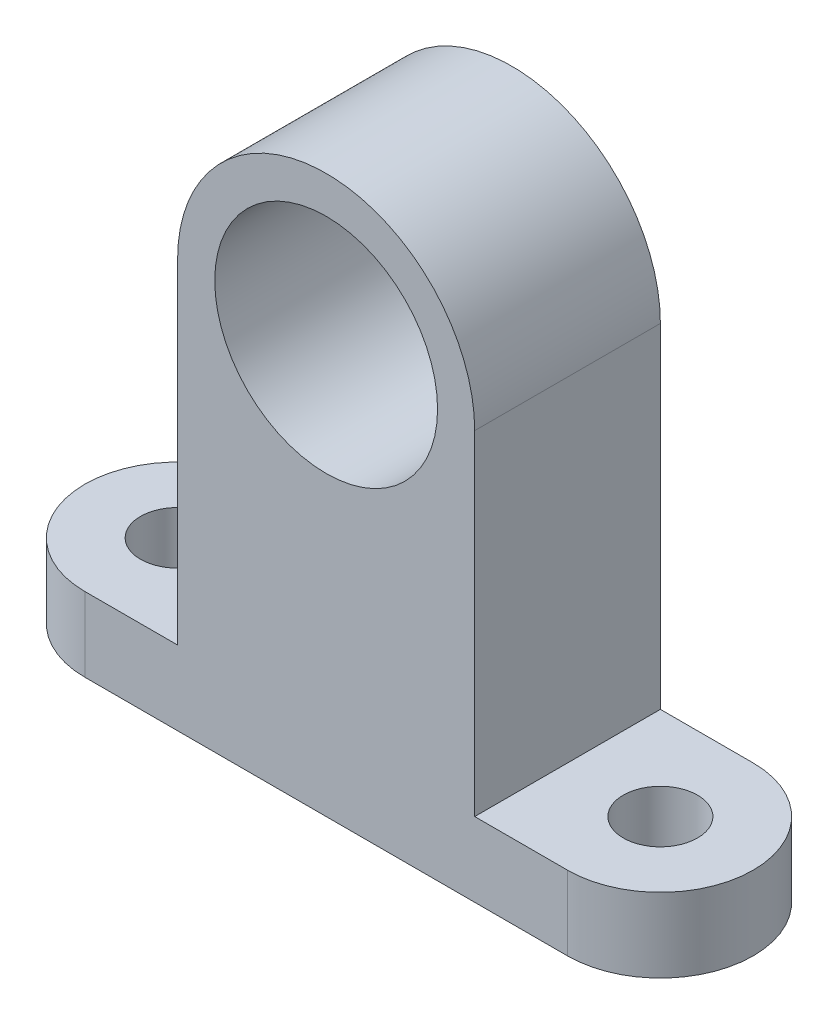
from build123d import *

# Parameters (mm, degrees)
SKETCH1_R           = 152.4
BOSS_EXTRUDE1_DEPTH = 127
SKETCH2_R           = 50.8
BOSS_EXTRUDE2_DEPTH = 101.6


with BuildPart() as part:
    # Sketch1 → Boss-Extrude1 (new, symmetric)
    with BuildSketch(Plane.XY):
        with BuildLine():
            Line((-203.2, -457.2), (203.2, -457.2))
            Line((203.2, -457.2), (203.2, 0))
            ThreePointArc((203.2, 0), (0, 203.2), (-203.2, 0))
            Line((-203.2, 0), (-203.2, -457.2))
        make_face()
        Circle(SKETCH1_R, mode=Mode.SUBTRACT)
    extrude(amount=BOSS_EXTRUDE1_DEPTH, both=True)

    # Sketch2 → Boss-Extrude2 (add)
    with BuildSketch(Plane.XZ.offset(457.2)):
        with BuildLine():
            Line((-203.2, -127), (203.2, -127))
            Line((203.2, -127), (330.2, -127))
            ThreePointArc((330.2, -127), (457.2, 0), (330.2, 127))
            Line((330.2, 127), (203.2, 127))
            Line((203.2, 127), (-203.2, 127))
            Line((-203.2, 127), (-330.2, 127))
            ThreePointArc((-330.2, 127), (-457.2, 0), (-330.2, -127))
            Line((-330.2, -127), (-203.2, -127))
        make_face()
        with Locations((-330.2, 0)):
            Circle(SKETCH2_R, mode=Mode.SUBTRACT)
        with Locations((330.2, 0)):
            Circle(SKETCH2_R, mode=Mode.SUBTRACT)
    extrude(amount=BOSS_EXTRUDE2_DEPTH)


solid = part.part
